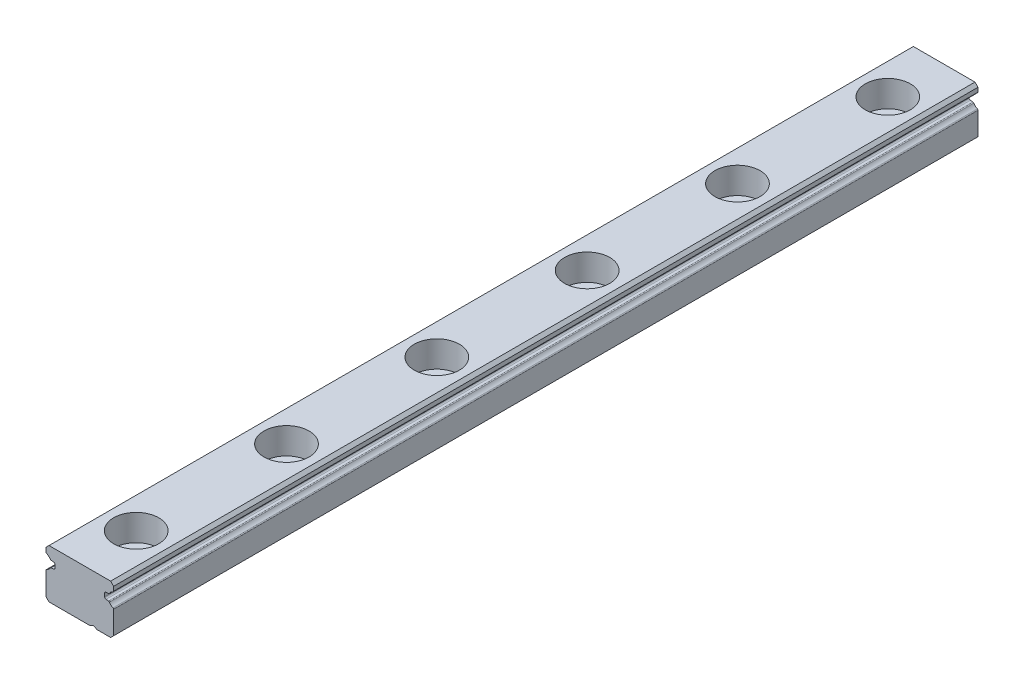
from build123d import *

# Parameters (mm, degrees)
BOSS_EXTRUDE1_START = 57.5
BOSS_EXTRUDE1_DEPTH = 115
LPATTERN1_COUNT     = 6
LPATTERN1_PITCH     = 20


with BuildPart() as part:
    # Sketch3 → Boss-Extrude1 (new body)
    with BuildSketch(Plane.XY.offset(BOSS_EXTRUDE1_START)):
        with BuildLine():
            Line((-4.5, 0.191696476), (-4.5, -2.85))
            Line((-4.5, -2.85), (-4.1, -3.25))
            Line((-4.1, -3.25), (1.4, -3.25))
            ThreePointArc((1.4, -3.25), (1.8, -3.05), (2.2, -3.25))
            Line((2.2, -3.25), (4.1, -3.25))
            Line((4.1, -3.25), (4.5, -2.85))
            Line((4.5, -2.85), (4.5, 0.191696476))
            ThreePointArc((4.5, 0.191696476), (4.475108648, 0.274448068), (4.408695652, 0.329735674))
            ThreePointArc((4.408695652, 0.329735674), (4.141262777, 0.497623907), (3.939510483, 0.740528855))
            ThreePointArc((3.939510483, 0.740528855), (3.890337026, 0.791057421), (3.823510417, 0.813537838))
            Line((3.823510417, 0.813537838), (3.482568852, 0.84336636))
            ThreePointArc((3.482568852, 0.84336636), (3.352544533, 0.907487258), (3.3, 1.042605299))
            Line((3.3, 1.042605299), (3.3, 1.457394701))
            ThreePointArc((3.3, 1.457394701), (3.352544533, 1.592512742), (3.482568852, 1.65663364))
            Line((3.482568852, 1.65663364), (3.823514163, 1.68646249))
            ThreePointArc((3.823514163, 1.68646249), (3.890340367, 1.708942652), (3.939513741, 1.759470648))
            ThreePointArc((3.939513741, 1.759470648), (4.141265182, 2.002372199), (4.408695652, 2.170258326))
            ThreePointArc((4.408695652, 2.170258326), (4.475108648, 2.225545932), (4.5, 2.308297524))
            Line((4.5, 2.308297524), (4.5, 2.85))
            Line((4.5, 2.85), (4.1, 3.25))
            Line((4.1, 3.25), (-4.1, 3.25))
            Line((-4.1, 3.25), (-4.5, 2.85))
            Line((-4.5, 2.85), (-4.5, 2.308297524))
            ThreePointArc((-4.5, 2.308297524), (-4.475108648, 2.225545932), (-4.408695652, 2.170258326))
            ThreePointArc((-4.408695652, 2.170258326), (-4.141265182, 2.002372199), (-3.939513741, 1.759470648))
            ThreePointArc((-3.939513741, 1.759470648), (-3.890340367, 1.708942652), (-3.823514163, 1.68646249))
            Line((-3.823514163, 1.68646249), (-3.482568852, 1.65663364))
            ThreePointArc((-3.482568852, 1.65663364), (-3.352544533, 1.592512742), (-3.3, 1.457394701))
            Line((-3.3, 1.457394701), (-3.3, 1.042605299))
            ThreePointArc((-3.3, 1.042605299), (-3.352544533, 0.907487258), (-3.482568852, 0.84336636))
            Line((-3.482568852, 0.84336636), (-3.823510417, 0.813537838))
            ThreePointArc((-3.823510417, 0.813537838), (-3.890337026, 0.791057421), (-3.939510483, 0.740528855))
            ThreePointArc((-3.939510483, 0.740528855), (-4.141262777, 0.497623907), (-4.408695652, 0.329735674))
            ThreePointArc((-4.408695652, 0.329735674), (-4.475108648, 0.274448068), (-4.5, 0.191696476))
        make_face()
    extrude(amount=-BOSS_EXTRUDE1_DEPTH)

    # Sketch4 → Cut-Revolve1 (revolve, cut)
    with BuildSketch(Plane.XY.offset(50)):
        Polygon((0, 3.25), (0, -3.25), (-1.75, -3.25), (-1.75, -0.25), (-3, -0.25), (-3, 3.25), align=None)
    cut_revolve1 = revolve(axis=Axis((0, 3.25, 50), (0, -1, 0)), mode=Mode.SUBTRACT)

    # LPattern1: Cut-Revolve1 ×6
    with Locations(*[(0, 0, -i * LPATTERN1_PITCH) for i in range(1, LPATTERN1_COUNT)]):
        add(cut_revolve1, mode=Mode.SUBTRACT)


solid = part.part
